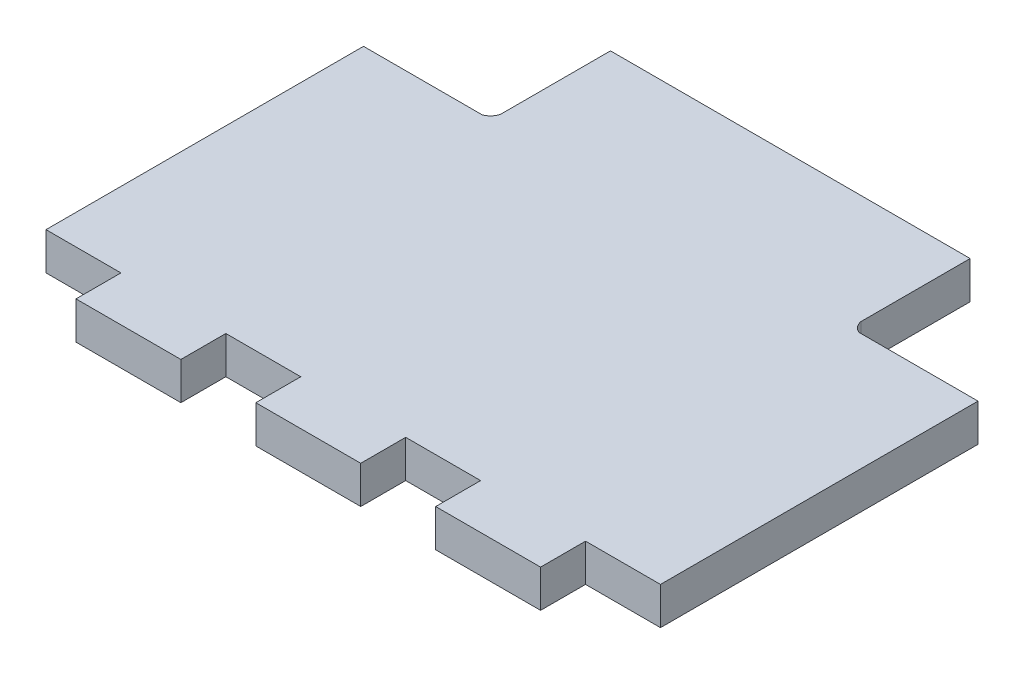
from build123d import *

# Parameters (mm, degrees)
SALIENTE_EXTRUIR1_DEPTH = 10
CROQUIS1_10_R           = 5
CORTAR_EXTRUIR1_DEPTH   = 6


with BuildPart() as part:
    # Croquis1 → Saliente-Extruir1 (new body)
    with BuildSketch(Plane(origin=(0, 0, 0), x_dir=(1, 0, 0), z_dir=(0, 1, 0))):
        with BuildLine():
            Line((-60.914821384, -22.524031449), (-40.914821384, -22.524031449))
            Line((-40.914821384, -22.524031449), (-40.914821384, -34.524031449))
            Line((-40.914821384, -34.524031449), (-12.914821384, -34.524031449))
            Line((-12.914821384, -34.524031449), (-12.914821384, -22.524031449))
            Line((-12.914821384, -22.524031449), (7.085178616, -22.524031449))
            Line((7.085178616, -22.524031449), (7.085178616, -34.524031449))
            Line((7.085178616, -34.524031449), (35.085178616, -34.524031449))
            Line((35.085178616, -34.524031449), (35.085178616, -22.524031449))
            Line((35.085178616, -22.524031449), (55.085178616, -22.524031449))
            Line((55.085178616, -22.524031449), (55.085178616, -34.524031449))
            Line((55.085178616, -34.524031449), (83.085178616, -34.524031449))
            Line((83.085178616, -34.524031449), (83.085178616, -22.524031449))
            Line((83.085178616, -22.524031449), (103.085178616, -22.524031449))
            Line((103.085178616, -22.524031449), (103.085178616, 62.217775428))
            Line((103.085178616, 62.217775428), (71.349410248, 62.217775428))
            ThreePointArc((71.349410248, 62.217775428), (69.870831169, 63.28983211), (69.085178616, 64.938544239))
            Line((69.085178616, 64.938544239), (69.085178616, 94.127666629))
            Line((69.085178616, 94.127666629), (-26.914821384, 94.127666629))
            Line((-26.914821384, 94.127666629), (-26.914821384, 64.848788639))
            ThreePointArc((-26.914821384, 64.848788639), (-27.737578388, 63.243349526), (-29.221681351, 62.217775428))
            Line((-29.221681351, 62.217775428), (-60.914821384, 62.217775428))
            Line((-60.914821384, 62.217775428), (-60.914821384, -22.524031449))
        make_face()
    extrude(amount=SALIENTE_EXTRUIR1_DEPTH)

    # Croquis1<10> → Cortar-Extruir1 (cut)
    with BuildSketch(Plane(origin=(0, 0, 0), x_dir=(1, 0, 0), z_dir=(0, 1, 0))):
        with Locations((0, 35.380497461)):
            Circle(CROQUIS1_10_R)
        with Locations((40, 35.380497461)):
            Circle(CROQUIS1_10_R)
    extrude(amount=CORTAR_EXTRUIR1_DEPTH, mode=Mode.SUBTRACT)


solid = part.part
